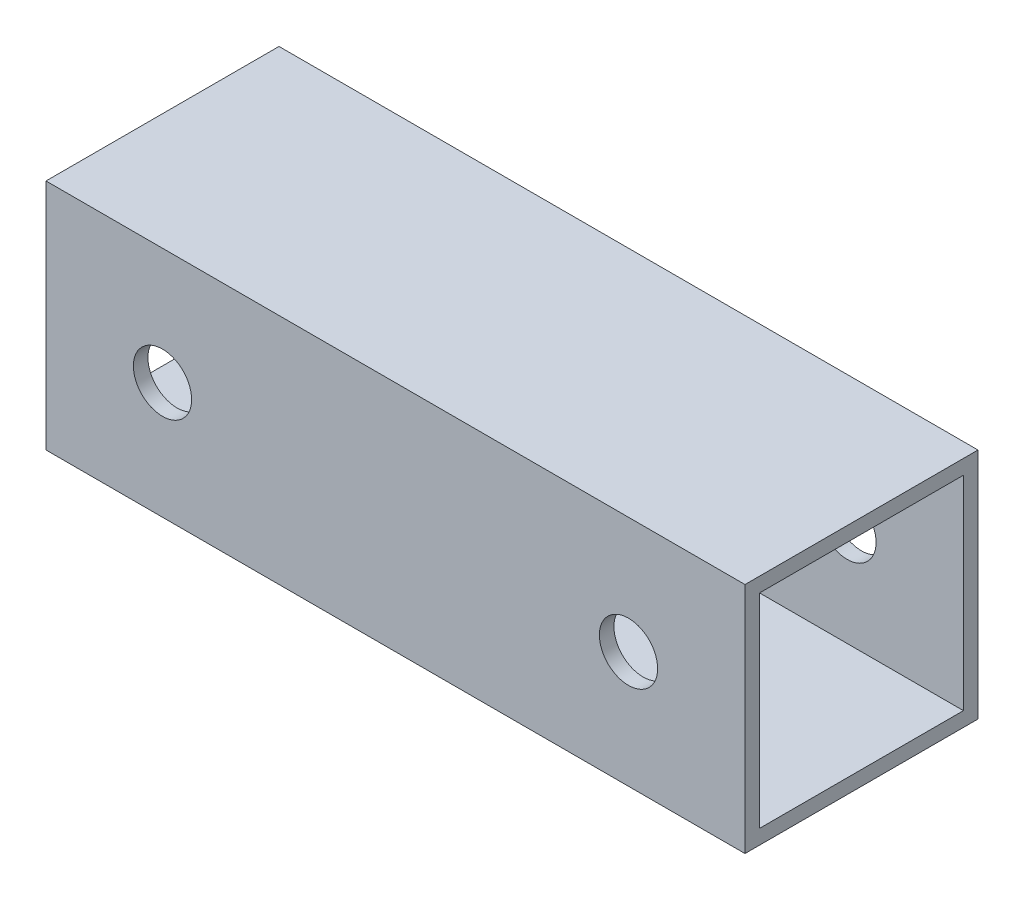
from build123d import *

# Parameters (mm, degrees)
SKETCH1_W           = 25.4
SKETCH1_H           = 25.4
SKETCH1_W_2         = 22.225
SKETCH1_H_2         = 22.225
BOSS_EXTRUDE1_DEPTH = 76.2
SKETCH2_R           = 3.175
CUT_EXTRUDE1_DEPTH  = 82.319677815


with BuildPart() as part:
    # Sketch1 → Boss-Extrude1 (new body)
    with BuildSketch(Plane(origin=(0, 0, 0), x_dir=(0, 0, -1), z_dir=(1, 0, 0))):
        Rectangle(SKETCH1_W, SKETCH1_H)
        Rectangle(SKETCH1_W_2, SKETCH1_H_2, mode=Mode.SUBTRACT)
    extrude(amount=BOSS_EXTRUDE1_DEPTH)

    # Sketch2 → Cut-Extrude1 (cut, through all)
    with BuildSketch(Plane.XY.offset(12.7)):
        with Locations((12.7, 0)):
            Circle(SKETCH2_R)
        with Locations((63.5, 0)):
            Circle(SKETCH2_R)
    extrude(amount=-CUT_EXTRUDE1_DEPTH, mode=Mode.SUBTRACT)


solid = part.part
